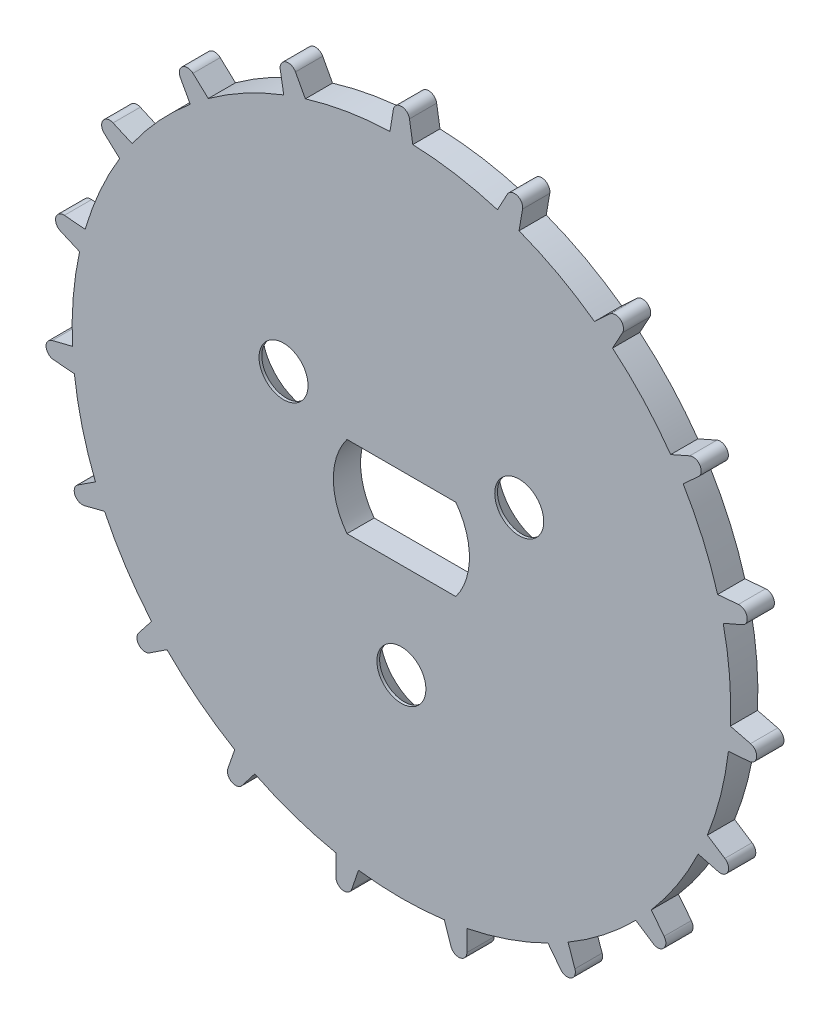
from build123d import *

# Parameters (mm, degrees)
MODEL_R                     = 12.1
EXTRUDE_318_DEPTH           = 0.5
CUT_EXTRUDE_1_DEPTH         = 18.141178489
EXTRUDE_892_DEPTH           = 1
PATTERN_CIRCULAR_946_COUNT  = 19
HOLE_WIZARD_M1_6_AT_2_COUNT = 2
HOLE_WIZARD_M1_6_AT_2_PITCH = 8.660254038
HOLE_WIZARD_M1_6_AT_3_COUNT = 2
HOLE_WIZARD_M1_6_AT_3_PITCH = 8.660254038


with BuildPart() as part:
    # Model → Extrude 318 (new, symmetric)
    with BuildSketch(Plane.XY):
        Circle(MODEL_R)
    extrude(amount=EXTRUDE_318_DEPTH, both=True)

    # Эскиз3 → Вырез-Вытянуть1 (cut, through all)
    with BuildSketch(Plane.XY.offset(0.5)):
        with BuildLine():
            Line((2, -1.5), (-2, -1.5))
            ThreePointArc((-2, -1.5), (-2.5, 0), (-2, 1.5))
            Line((-2, 1.5), (2, 1.5))
            ThreePointArc((2, 1.5), (2.5, 0), (2, -1.5))
        make_face()
    extrude(amount=-CUT_EXTRUDE_1_DEPTH, mode=Mode.SUBTRACT)

    # Эскиз4 → Extrude 892 (add)
    with BuildSketch(Plane.XY.offset(0.5)):
        with BuildLine():
            Line((-0.5, 11.6), (0.5, 11.6))
            Line((0.5, 11.6), (0.29607573, 12.848364887))
            ThreePointArc((0.29607573, 12.848364887), (0, 13.1), (-0.29607573, 12.848364887))
            Line((-0.29607573, 12.848364887), (-0.5, 11.6))
        make_face()
    extrude_892 = extrude(amount=-EXTRUDE_892_DEPTH)

    # Pattern Circular 946: Extrude 892 ×19 about axis
    pattern_circular_946_axis = Axis((0, 0, 0), (0, 0, 1))
    for i in range(1, PATTERN_CIRCULAR_946_COUNT):
        add(extrude_892.rotate(pattern_circular_946_axis, i * 360 / PATTERN_CIRCULAR_946_COUNT))

    # Эскиз6 → Крепление шестерни M1.6 (revolve, cut)
    with BuildSketch(Plane(origin=(4.330127019, 2.5, -0.5), x_dir=(0, 1, 0), z_dir=(1, 0, 0))):
        Polygon((0, 0), (0, 1), (0.9, 1), (0.9, 0.9), (1.8, 0), align=None)
    hole_wizard_m1_6 = revolve(axis=Axis((4.330127019, 2.5, -6.85), (0, 0, 1)), mode=Mode.SUBTRACT)

    # Крепление шестерни M1.6 at 2: Крепление шестерни M1.6 ×2
    with Locations(*[Vector(-0.49999999999999795, -0.8660254037844399, 0) * (i * HOLE_WIZARD_M1_6_AT_2_PITCH) for i in range(1, HOLE_WIZARD_M1_6_AT_2_COUNT)]):
        add(hole_wizard_m1_6, mode=Mode.SUBTRACT)

    # Крепление шестерни M1.6 at 3: Крепление шестерни M1.6 ×2
    with Locations(*[(-i * HOLE_WIZARD_M1_6_AT_3_PITCH, 0, 0) for i in range(1, HOLE_WIZARD_M1_6_AT_3_COUNT)]):
        add(hole_wizard_m1_6, mode=Mode.SUBTRACT)


solid = part.part
